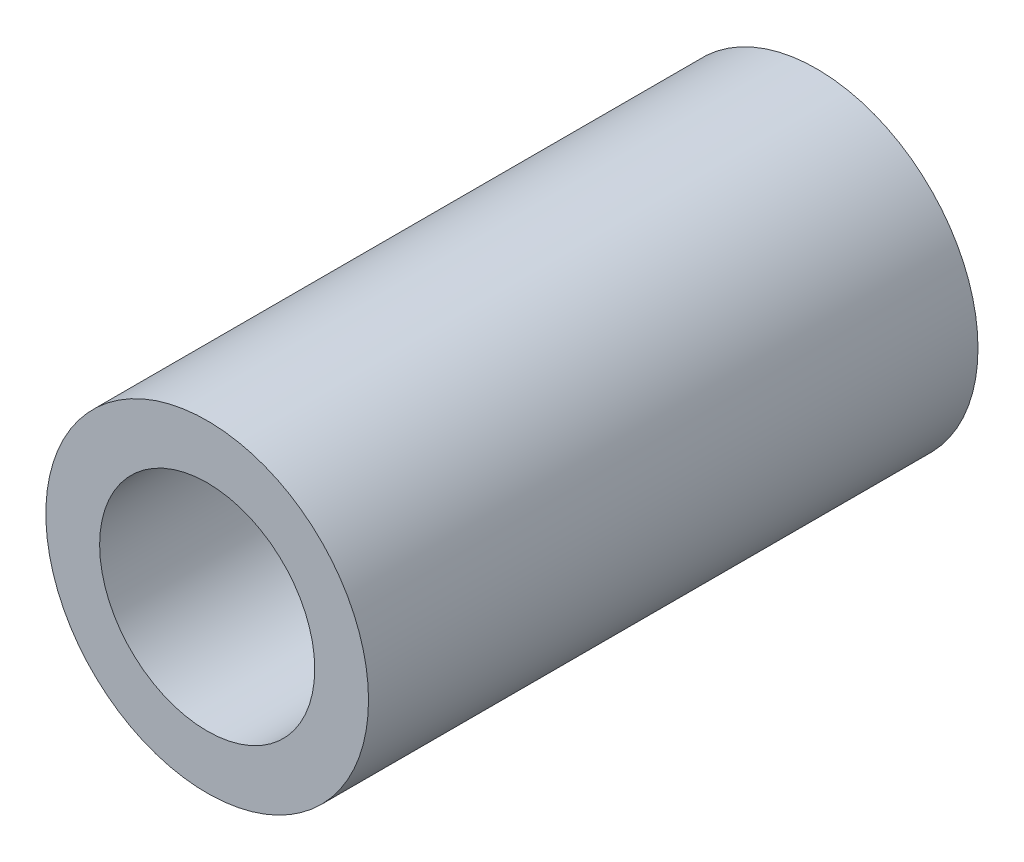
from build123d import *

# Parameters (mm, degrees)
SKETCH1_R           = 9
SKETCH1_R_2         = 6
BOSS_EXTRUDE1_DEPTH = 17


with BuildPart() as part:
    # Sketch1 → Boss-Extrude1 (new, symmetric)
    with BuildSketch(Plane.XY):
        Circle(SKETCH1_R)
        Circle(SKETCH1_R_2, mode=Mode.SUBTRACT)
    extrude(amount=BOSS_EXTRUDE1_DEPTH, both=True)


solid = part.part
